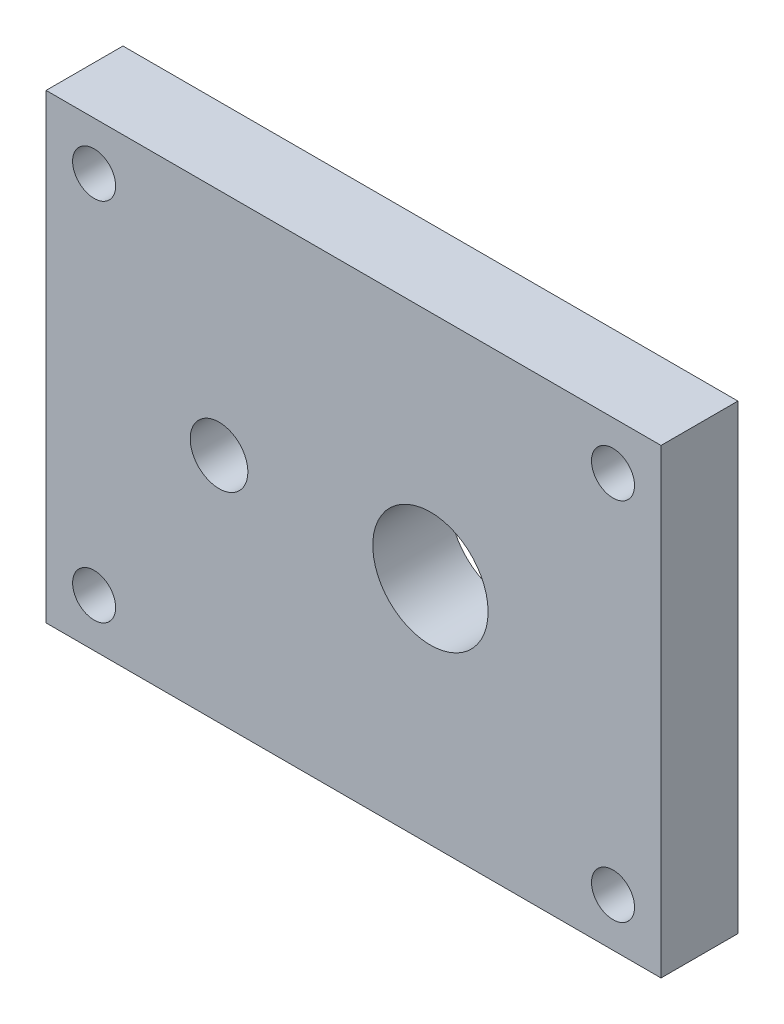
from build123d import *

# Parameters (mm, degrees)
SKETCH1_W           = 50.8
SKETCH1_H           = 38.1
BOSS_EXTRUDE1_DEPTH = 6.35
SKETCH2_R           = 2.38125
SKETCH2_R_2         = 4.7625
CUT_EXTRUDE1_DEPTH  = 38.567106623
SKETCH3_R           = 1.778
CUT_EXTRUDE2_DEPTH  = 38.567106623


with BuildPart() as part:
    # Sketch1 → Boss-Extrude1 (new body)
    with BuildSketch(Plane.XY):
        with Locations((-6.35, 0)):
            Rectangle(SKETCH1_W, SKETCH1_H)
    extrude(amount=BOSS_EXTRUDE1_DEPTH)

    # Sketch2 → Cut-Extrude1 (cut, through all)
    with BuildSketch(Plane.XY.offset(6.35)):
        with Locations((-17.462302917, 0.082964446)):
            Circle(SKETCH2_R)
        Circle(SKETCH2_R_2)
    extrude(amount=-CUT_EXTRUDE1_DEPTH, mode=Mode.SUBTRACT)

    # Sketch3 → Cut-Extrude2 (cut, through all)
    with BuildSketch(Plane.XY.offset(6.35)):
        with Locations((-27.78125, 15.08125)):
            Circle(SKETCH3_R)
        with Locations((15.08125, 15.08125)):
            Circle(SKETCH3_R)
        with Locations((15.08125, -15.08125)):
            Circle(SKETCH3_R)
        with Locations((-27.78125, -15.08125)):
            Circle(SKETCH3_R)
    extrude(amount=-CUT_EXTRUDE2_DEPTH, mode=Mode.SUBTRACT)


solid = part.part
